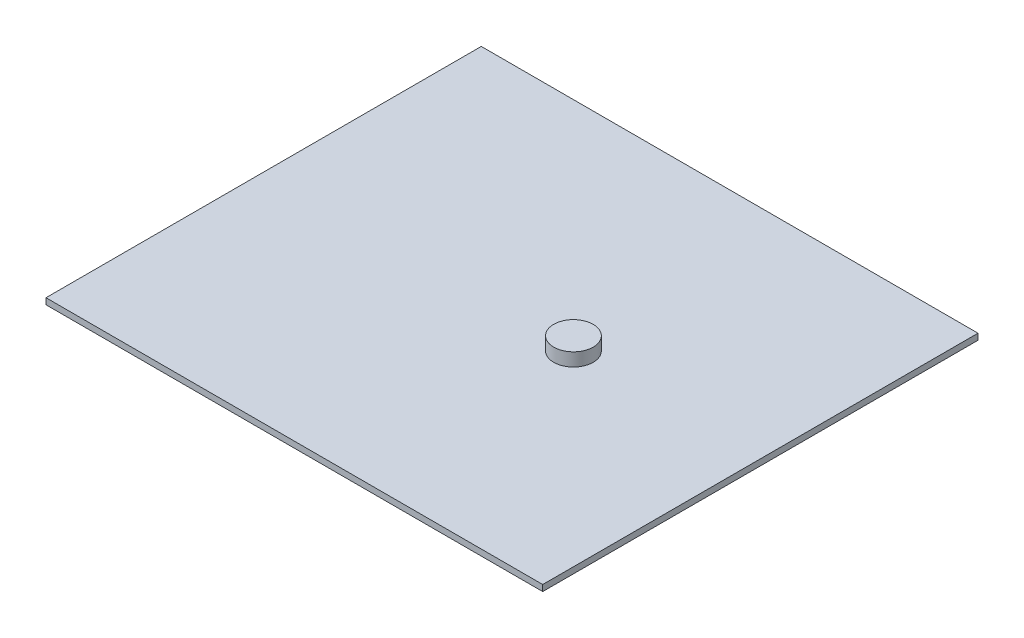
from build123d import *

# Parameters (mm, degrees)
SKETCH1_W           = 565.88
SKETCH1_H           = 495.88
BOSS_EXTRUDE1_DEPTH = 3.5
SKETCH2_R           = 22.5
BOSS_EXTRUDE2_DEPTH = 15


with BuildPart() as part:
    # Sketch1 → Boss-Extrude1 (new, symmetric)
    with BuildSketch(Plane(origin=(0, 0, 0), x_dir=(1, 0, 0), z_dir=(0, 1, 0))):
        Rectangle(SKETCH1_W, SKETCH1_H)
    extrude(amount=BOSS_EXTRUDE1_DEPTH, both=True)

    # Sketch2 → Boss-Extrude2 (add)
    with BuildSketch(Plane(origin=(0, 3.5, 0), x_dir=(1, 0, 0), z_dir=(0, 1, 0))):
        with Locations(Location((70, 0, 0), (0, 0, 270))):
            Circle(SKETCH2_R)
    extrude(amount=BOSS_EXTRUDE2_DEPTH)


solid = part.part
